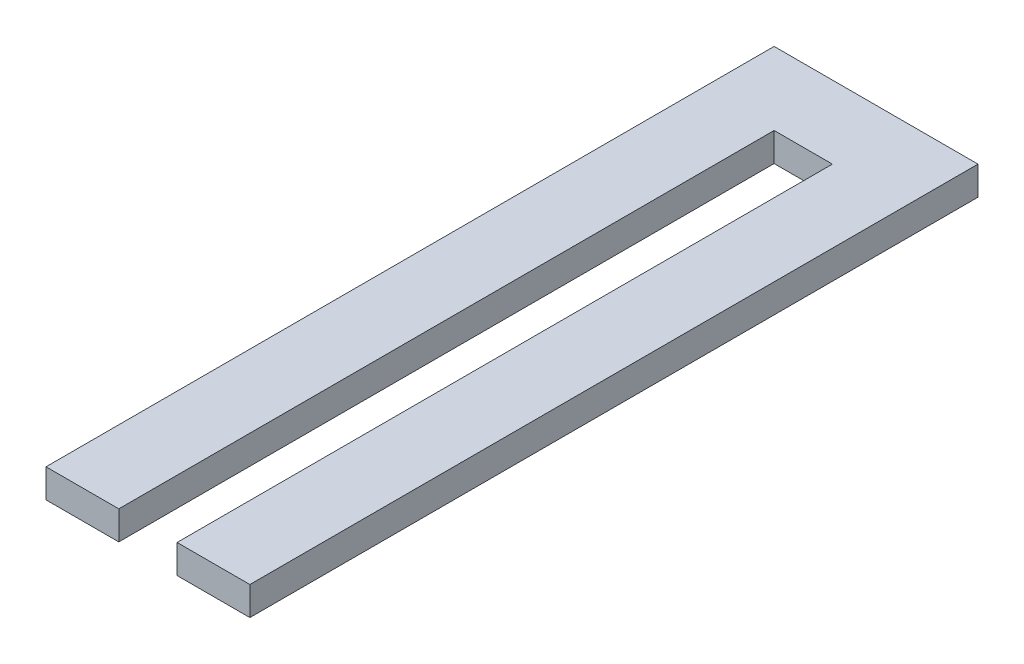
from build123d import *

# Parameters (mm, degrees)
BOSS_EXTRUDE1_DEPTH = 5


with BuildPart() as part:
    # Sketch1 → Boss-Extrude1 (new body)
    with BuildSketch(Plane(origin=(0, 0, 0), x_dir=(1, 0, 0), z_dir=(0, 1, 0))):
        Polygon((-4.277894737, 0), (5.882105263, 0), (5.882105263, -114.3), (18.582105263, -114.3), (18.582105263, 12.7), (-16.977894737, 12.7), (-16.977894737, -114.3), (-4.277894737, -114.3), align=None)
    extrude(amount=BOSS_EXTRUDE1_DEPTH)


solid = part.part
